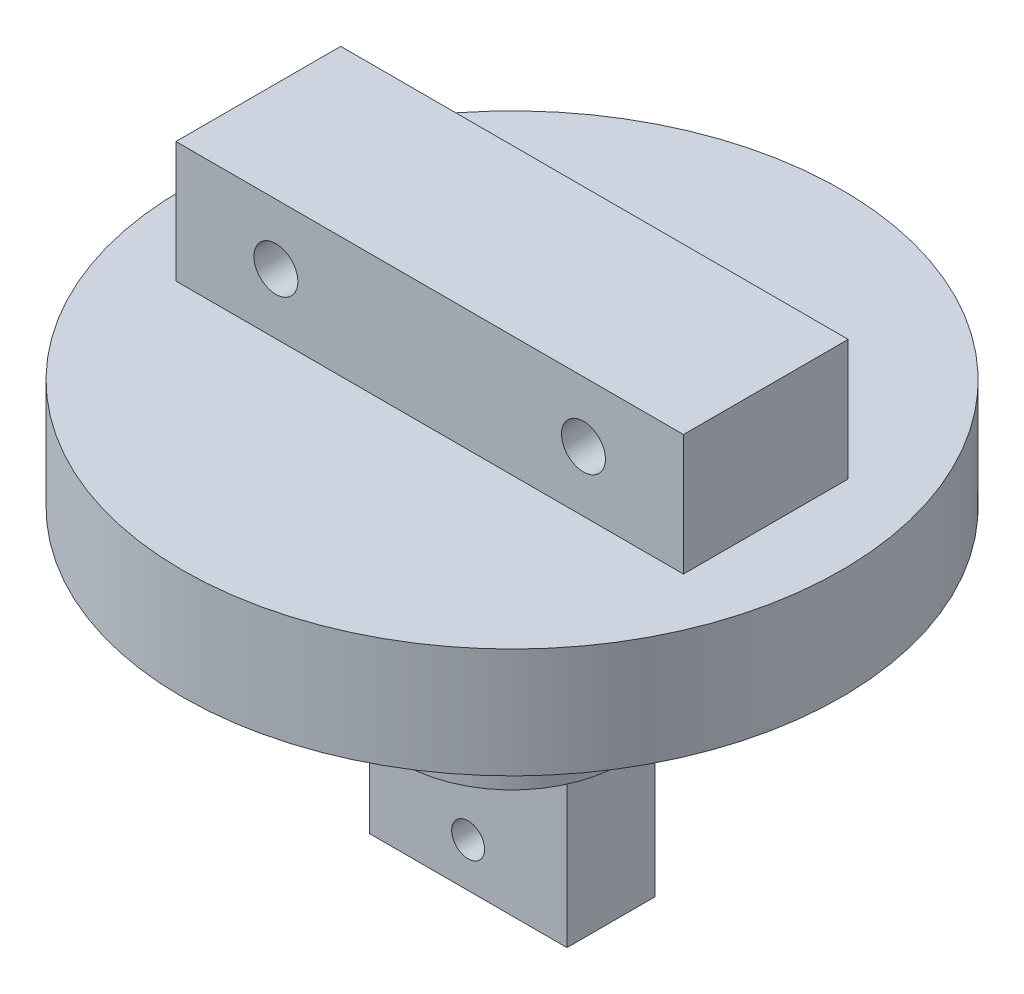
from build123d import *

# Parameters (mm, degrees)
SKETCH1_R                = 30
BOSS_EXTRUDE1_DEPTH      = 10
SKETCH2_R                = 10
BOSS_EXTRUDE2_DEPTH      = 15.25
BOSS_EXTRUDE3_DEPTH      = 13
F_3_0_3_DIAMETER_HOLE1_D = 3
BOSS_EXTRUDE4_DEPTH      = 11
F_4_0_4_DIAMETER_HOLE1_D = 4


with BuildPart() as part:
    # Sketch1 → Boss-Extrude1 (new body)
    with BuildSketch(Plane(origin=(0, 0, 0), x_dir=(1, 0, 0), z_dir=(0, 1, 0))):
        with Locations(Location((0, 0, 0), (0, 0, 270))):
            Circle(SKETCH1_R)
    extrude(amount=BOSS_EXTRUDE1_DEPTH)

    # Sketch2 → Boss-Extrude2 (add)
    with BuildSketch(Plane(origin=(0, 0, 0), x_dir=(-1, 0, 0), z_dir=(0, -1, 0))):
        with Locations(Location((0, 0, 0), (0, 0, 270))):
            Circle(SKETCH2_R)
    extrude(amount=BOSS_EXTRUDE2_DEPTH)

    # Sketch3 → Boss-Extrude3 (add)
    with BuildSketch(Plane(origin=(0, -15.25, 0), x_dir=(-1, 0, 0), z_dir=(0, -1, 0))):
        Polygon((-9, 4), (-9, 0), (-9, -4), (9, -4), (9, 4), align=None)
    extrude(amount=BOSS_EXTRUDE3_DEPTH)

    # Ø3.0 (3) Diameter Hole1 (through all)
    with Locations(Plane.XY.offset(4)):
        with Locations((0, -24.25), (0, -18.25)):
            Hole(F_3_0_3_DIAMETER_HOLE1_D / 2)

    # Sketch8 → Boss-Extrude4 (add)
    with BuildSketch(Plane(origin=(0, 10, 0), x_dir=(1, 0, 0), z_dir=(0, 1, 0))):
        Polygon((-23.1, -7.5), (-23.1, 0), (-23.1, 7.5), (23.1, 7.5), (23.1, -7.5), align=None)
    extrude(amount=BOSS_EXTRUDE4_DEPTH)

    # Ø4.0 (4) Diameter Hole1 (through all)
    with Locations(Plane(origin=(0, 0, -7.5), x_dir=(-1, 0, 0), z_dir=(0, 0, -1))):
        with Locations((-14, 15.5), (14, 15.5)):
            Hole(F_4_0_4_DIAMETER_HOLE1_D / 2)


solid = part.part
